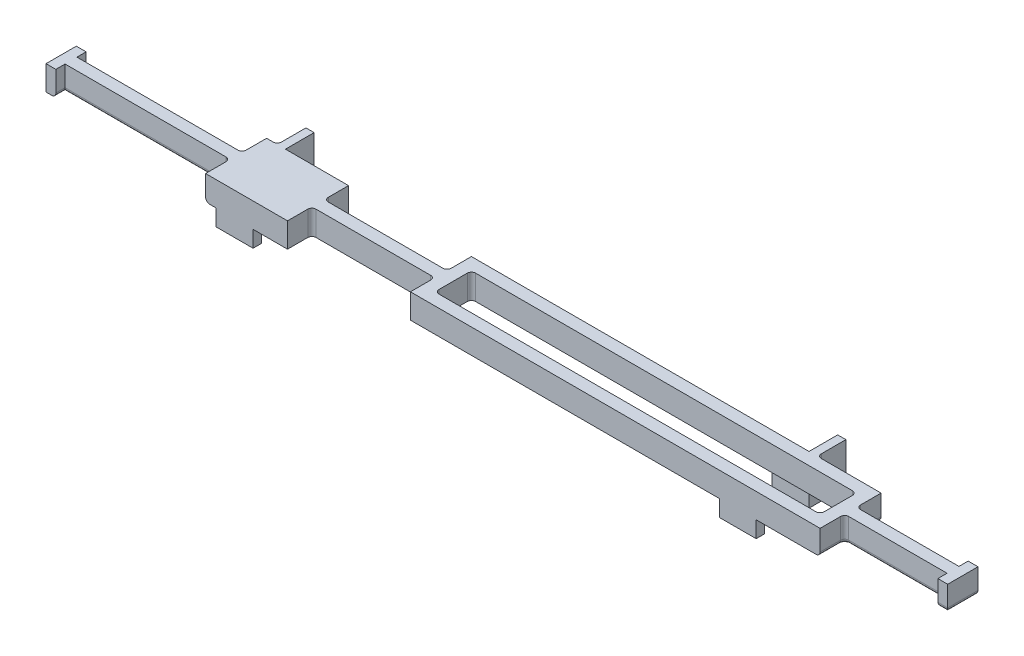
from build123d import *

# Parameters (mm, degrees)
SKETCH1_W               = 94
SKETCH1_H               = 8.9
BOSS_EXTRUDE1_DEPTH     = 6
BOSS_EXTRUDE2_DEPTH     = 10
FILLET1_R               = 1
CUT_EXTRUDE1_DEPTH      = 113.775218909
CUT_EXTRUDE1_DEPTH_BACK = 113.775218909
SKETCH3_W               = 150
SKETCH3_H               = 7


with BuildPart() as part:
    # Sketch1 → Boss-Extrude1 (new body)
    with BuildSketch(Plane(origin=(0, 0, 0), x_dir=(1, 0, 0), z_dir=(0, 1, 0))):
        Polygon((106.5, 2.9), (106.5, 5.15), (108.9, 5.15), (108.9, -2.25), (106.5, -2.25), (106.5, 0), (81.5, 0), (81.5, -6), (-18.5, -6), (-18.5, -0.05), (-48.5, -0.05), (-48.5, -6), (-68.5, -6), (-68.5, 0), (-108.8, 0), (-108.8, -2.25), (-111.2, -2.25), (-111.2, 5.15), (-108.8, 5.15), (-108.8, 2.9), (-68.5, 2.9), (-68.5, 8.9), (-48.5, 8.9), (-48.5, 2.95), (-18.5, 2.95), (-18.5, 8.9), (81.5, 8.9), (81.5, 2.9), align=None)
        with Locations((31.5, 1.45)):
            Rectangle(SKETCH1_W, SKETCH1_H, mode=Mode.SUBTRACT)
    extrude(amount=BOSS_EXTRUDE1_DEPTH)

    # Sketch2 → Boss-Extrude2 (add)
    with BuildSketch(Plane(origin=(0, 6, 0), x_dir=(1, 0, 0), z_dir=(0, 1, 0))):
        Polygon((-65.9, 6.9), (-65.9, 15.9), (-63.9, 15.9), (-63.9, 8.9), (-56.9, 8.9), (-56.9, 6.9), align=None)
        Polygon((-65.9, -4), (-56.9, -4), (-56.9, -6), (-63.9, -6), (-63.9, -13), (-65.9, -13), align=None)
        Polygon((65.9, -13), (65.9, -4), (56.9, -4), (56.9, -6), (63.9, -6), (63.9, -13), align=None)
        Polygon((56.9, 6.9), (65.9, 6.9), (65.9, 15.9), (63.9, 15.9), (63.9, 8.9), (56.9, 8.9), align=None)
    extrude(amount=-BOSS_EXTRUDE2_DEPTH)

    # Fillet1
    fillet1_edges = [part.edges().sort_by_distance(p)[0] for p in [
        (-68.5, 0, 3),
        (-68.5, 0, -5.9),
        (-108.8, 0, -4.025),
        (-108.8, 0, 1.125),
        (-68.5, 3, 0),
        (-68.5, 3, -2.9),
        (-88.65, 0, 0),
        (-88.65, 0, -2.9),
        (81.5, 0, -5.9),
        (81.5, 0, 3),
        (78.5, 3, -5.9),
        (78.5, 3, 3),
        (-15.5, 3, 3),
        (-15.5, 3, -5.9),
        (-18.5, 3, -2.95),
        (-18.5, 3, 0.05),
        (-48.5, 3, -2.95),
        (-48.5, 3, 0.05),
        (-65.9, 3, 6),
        (-65.9, 3, -8.9),
        (65.9, 3, -8.9),
        (65.9, 3, 6),
        (81.5, 3, -2.9),
        (81.5, 3, 0),
        (106.5, 0, 1.125),
        (107.7, 0, 2.25),
        (108.9, 0, -1.45),
        (107.7, 0, -5.15),
        (106.5, 0, -4.025),
        (94, 0, -2.9),
        (94, 0, 0),
    ]]
    fillet(fillet1_edges, radius=FILLET1_R)

    # Sketch3 → Cut-Extrude1 (cut, two sides: drawn at the far end of the back side and taken through both)
    with BuildSketch(Plane(origin=(0, 6, 0), x_dir=(1, 0, 0), z_dir=(0, 1, 0)).offset(-CUT_EXTRUDE1_DEPTH_BACK)):
        with Locations((6.5, -9.5)):
            Rectangle(SKETCH3_W, SKETCH3_H)
    extrude(amount=CUT_EXTRUDE1_DEPTH + CUT_EXTRUDE1_DEPTH_BACK, mode=Mode.SUBTRACT)


solid = part.part
